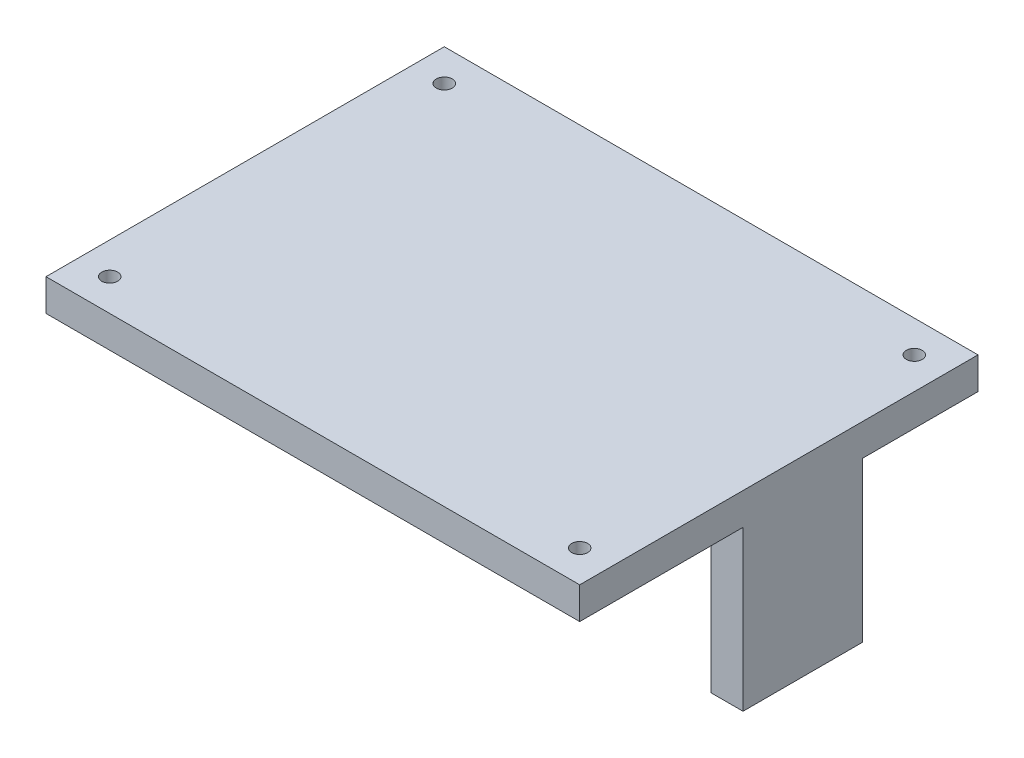
from build123d import *

# Parameters (mm, degrees)
SKETCH1_R           = 0.5
BOSS_EXTRUDE1_DEPTH = 2
SKETCH2_W           = 2
SKETCH2_H           = 7.5
BOSS_EXTRUDE2_DEPTH = 10


with BuildPart() as part:
    # Sketch1 → Boss-Extrude1 (new body)
    # profile 1 of 2: a face of its own
    with BuildSketch(Plane(origin=(0, 9.868787402, 0), x_dir=(1, 0, 0), z_dir=(0, 1, 0))):
        Polygon((40.744370356, 16.373895208), (40.744370356, 8.373895208), (38.744370356, 8.373895208), (38.744370356, 2.373895208), (36.744370356, 2.373895208), (36.744370356, 0.373895208), (11.244370356, 0.373895208), (11.244370356, 2.373895208), (9.244370356, 2.373895208), (9.244370356, 19.373895208), (11.244370356, 19.373895208), (11.244370356, 21.373895208), (36.744370356, 21.373895208), (36.744370356, 19.373895208), (38.744370356, 19.373895208), (38.744370356, 16.373895208), align=None)
    # profile 2 of 2: a face of its own
    with BuildSketch(Plane(origin=(0, 9.868787402, 0), x_dir=(1, 0, 0), z_dir=(0, 1, 0))):
        Polygon((40.744370356, 8.373895208), (38.744370356, 8.373895208), (38.744370356, 2.373895208), (36.744370356, 2.373895208), (36.744370356, 0.373895208), (11.244370356, 0.373895208), (11.244370356, 2.373895208), (9.244370356, 2.373895208), (9.244370356, 19.373895208), (11.244370356, 19.373895208), (11.244370356, 21.373895208), (36.744370356, 21.373895208), (36.744370356, 19.373895208), (38.744370356, 19.373895208), (38.744370356, 16.373895208), (40.744370356, 16.373895208), (40.744370356, 23.373895208), (7.244370356, 23.373895208), (7.244370356, -1.626104792), (40.744370356, -1.626104792), align=None)
        with Locations(Location((9.244370356, 21.373895208, 0), (0, 0, 270))):
            Circle(SKETCH1_R, mode=Mode.SUBTRACT)
        with Locations(Location((38.744370356, 0.373895208, 0), (0, 0, 270))):
            Circle(SKETCH1_R, mode=Mode.SUBTRACT)
        with Locations(Location((38.744370356, 21.373895208, 0), (0, 0, 270))):
            Circle(SKETCH1_R, mode=Mode.SUBTRACT)
        with Locations(Location((9.244370356, 0.373895208, 0), (0, 0, 270))):
            Circle(SKETCH1_R, mode=Mode.SUBTRACT)
    extrude(amount=BOSS_EXTRUDE1_DEPTH)

    # Sketch2 → Boss-Extrude2 (add)
    with BuildSketch(Plane.XZ.offset(-9.868787402)):
        with Locations((39.744370356, -12.373895208)):
            Rectangle(SKETCH2_W, SKETCH2_H)
    extrude(amount=BOSS_EXTRUDE2_DEPTH)


solid = part.part
